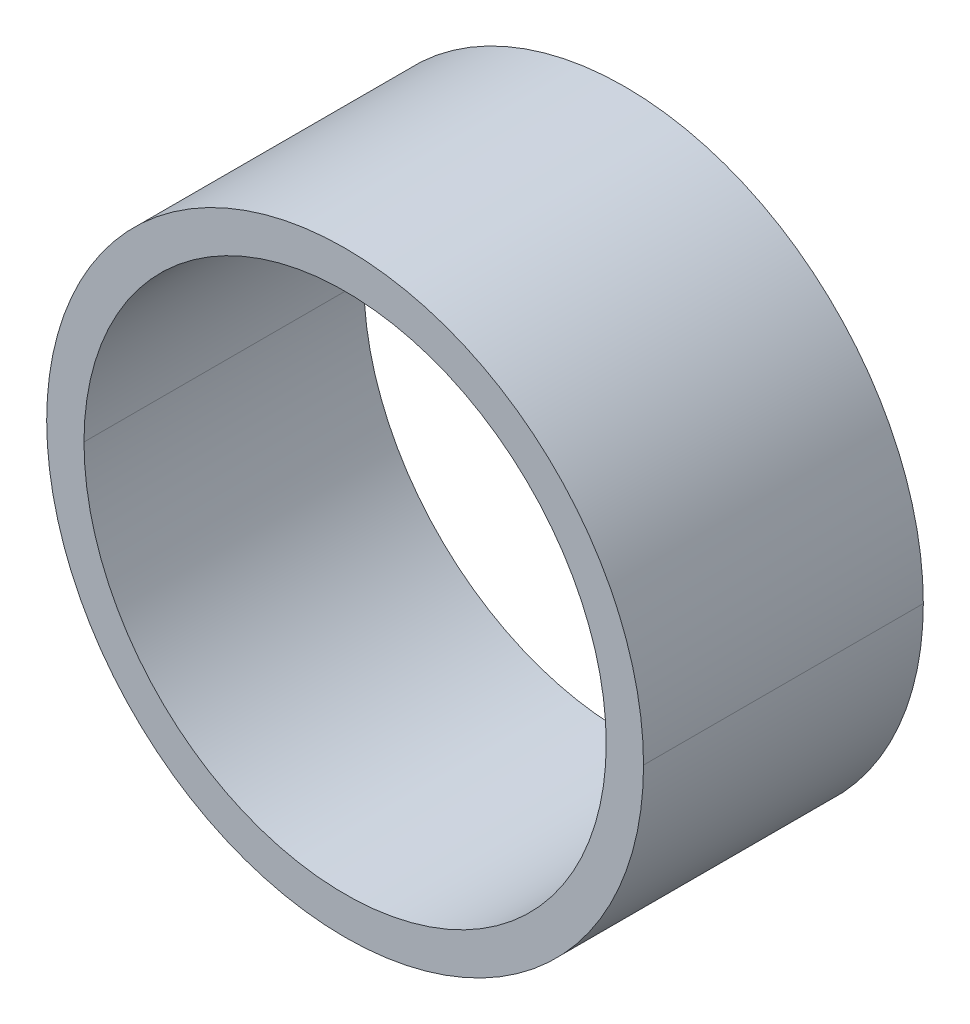
from build123d import *

# Parameters (mm, degrees)
SKETCH1_R      = 20.32
SKETCH1_R_2    = 17.78
EXTRUDE1_DEPTH = 19.05


with BuildPart() as part:
    # Sketch1 → Extrude1 (new body)
    with BuildSketch(Plane.XY):
        with Locations(Location((0, 0, 0), (0, 0, 180))):
            Circle(SKETCH1_R)
        with Locations(Location((0, 0, 0), (0, 0, 180))):
            Circle(SKETCH1_R_2, mode=Mode.SUBTRACT)
    extrude(amount=EXTRUDE1_DEPTH)


solid = part.part
